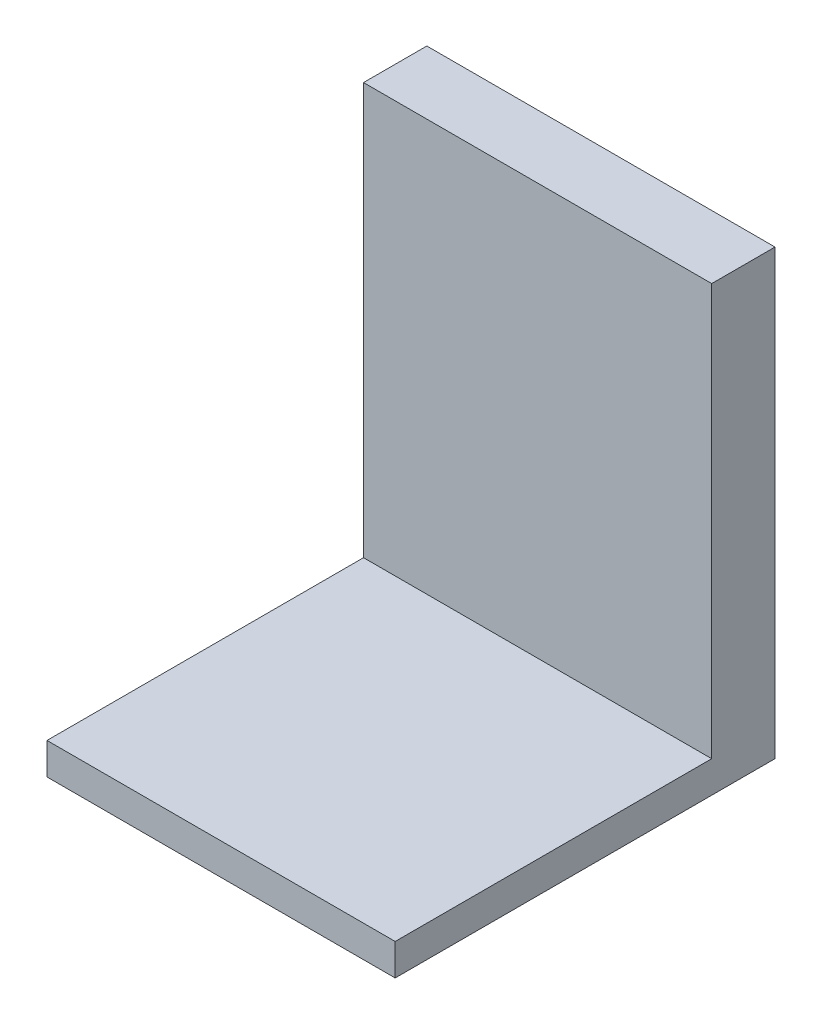
from build123d import *

# Parameters (mm, degrees)
SKETCH1_W                      = 670
SKETCH1_H                      = 120
BOSS_EXTRUDE1_DEPTH            = 530
SKETCH2_W                      = 100
SKETCH2_H                      = 200
SKETCH2_W_2                    = 650
SKETCH2_H_2                    = 250
CUT_EXTRUDE1_DEPTH             = 100
SKETCH3_R                      = 50
CUT_EXTRUDE2_DEPTH             = 260
F_12_0_12_DIAMETER_HOLE2_D     = 12
F_12_0_12_DIAMETER_HOLE2_DEPTH = 30
F_12_0_12_DIAMETER_HOLE2_TIP   = 3.605163714
SKETCH8_W                      = 650
SKETCH8_H                      = 50
BOSS_EXTRUDE2_DEPTH            = 5
SKETCH9_W                      = 10
SKETCH9_H                      = 250
CUT_EXTRUDE3_DEPTH             = 717
CUT_EXTRUDE4_DEPTH             = 5
SKETCH11_W                     = 10
SKETCH11_H                     = 100
BOSS_EXTRUDE3_DEPTH            = 78
BOSS_EXTRUDE3_2_DEPTH          = 78
BOSS_EXTRUDE3_3_DEPTH          = 78
SKETCH12_W                     = 20
SKETCH12_H                     = 30
CUT_EXTRUDE5_DEPTH             = 80
SKETCH15_W                     = 30
SKETCH15_H                     = 23.536156656
SKETCH15_H_2                   = 28.986603691
CUT_EXTRUDE7_DEPTH             = 35
SHELL1_T                       = -3
SKETCH16_W                     = 14
SKETCH16_H                     = 14
CUT_EXTRUDE8_DEPTH             = 35
SKETCH17_W                     = 5.729882812
SKETCH17_H                     = 17.428393554
SKETCH17_W_2                   = 13.369726562
SKETCH17_H_2                   = 3.342431641
BOSS_EXTRUDE4_DEPTH            = 5
CUT_EXTRUDE10_DEPTH            = 863.670273187
CUT_EXTRUDE10_DEPTH_BACK       = 863.670273187
SKETCH18_W                     = 670
SKETCH18_H                     = 250
CUT_EXTRUDE11_DEPTH            = 737.002717386
CUT_EXTRUDE11_DEPTH_BACK       = 737.002717386
SKETCH19_W                     = 448
SKETCH19_H                     = 280
SKETCH19_W_2                   = 112
CUT_EXTRUDE12_DEPTH            = 633.268930124
CUT_EXTRUDE12_DEPTH_BACK       = 633.268930124
SKETCH20_W                     = 110
SKETCH20_H                     = 140


with BuildPart() as part:
    # Sketch1 → Boss-Extrude1 (new body)
    with BuildSketch(Plane(origin=(0, 0, 0), x_dir=(1, 0, 0), z_dir=(0, 1, 0))):
        with Locations((335, 60)):
            Rectangle(SKETCH1_W, SKETCH1_H)
    extrude(amount=BOSS_EXTRUDE1_DEPTH)

    # Sketch2 → Cut-Extrude1 (cut)
    with BuildSketch(Plane.XY):
        with Locations((60, 380)):
            Rectangle(SKETCH2_W, SKETCH2_H)
        with Locations((170, 380)):
            Rectangle(SKETCH2_W, SKETCH2_H)
        with Locations((280, 380)):
            Rectangle(SKETCH2_W, SKETCH2_H)
        with Locations((390, 380)):
            Rectangle(SKETCH2_W, SKETCH2_H)
        with Locations((500, 380)):
            Rectangle(SKETCH2_W, SKETCH2_H)
        with Locations((610, 380)):
            Rectangle(SKETCH2_W, SKETCH2_H)
        with Locations((335, 135)):
            Rectangle(SKETCH2_W_2, SKETCH2_H_2)
    extrude(amount=-CUT_EXTRUDE1_DEPTH, mode=Mode.SUBTRACT)

    # Sketch3 → Cut-Extrude2 (cut)
    with BuildSketch(Plane(origin=(0, 530, 0), x_dir=(1, 0, 0), z_dir=(0, 1, 0))):
        with Locations(Location((60, 60, 0), (0, 0, 270))):
            Circle(SKETCH3_R)
        with Locations(Location((170, 60, 0), (0, 0, 270))):
            Circle(SKETCH3_R)
        with Locations(Location((280, 60, 0), (0, 0, 270))):
            Circle(SKETCH3_R)
        with Locations(Location((390, 60, 0), (0, 0, 270))):
            Circle(SKETCH3_R)
        with Locations(Location((500, 60, 0), (0, 0, 270))):
            Circle(SKETCH3_R)
        with Locations(Location((610, 60, 0), (0, 0, 270))):
            Circle(SKETCH3_R)
    extrude(amount=-CUT_EXTRUDE2_DEPTH, mode=Mode.SUBTRACT)

    # Ø12.0 (12) Diameter Hole2
    with Locations(Plane(origin=(59.704642413, 270, -102.411697903), x_dir=(0, 0, 1), z_dir=(0, 1, 0))):
        with Locations((0, 0), (-0.195888006, 111.8520513), (0.014838595, 221.167624818), (-0.341843303, 331.364008353), (0.657723149, 441.008646429), (1.288998006, 549.811854685)):
            Hole(F_12_0_12_DIAMETER_HOLE2_D / 2, depth=F_12_0_12_DIAMETER_HOLE2_DEPTH)
            with Locations((0, 0, -(F_12_0_12_DIAMETER_HOLE2_DEPTH + F_12_0_12_DIAMETER_HOLE2_TIP / 2))):  # 118° drill point
                Cone(0, F_12_0_12_DIAMETER_HOLE2_D / 2, F_12_0_12_DIAMETER_HOLE2_TIP, mode=Mode.SUBTRACT)

    # Sketch8 → Boss-Extrude2 (add)
    with BuildSketch(Plane.XY):
        with Locations((335, 305)):
            Rectangle(SKETCH8_W, SKETCH8_H)
    extrude(amount=-BOSS_EXTRUDE2_DEPTH)

    # Sketch9 → Cut-Extrude3 (cut)
    with BuildSketch(Plane(origin=(670, 0, 0), x_dir=(0, 0, -1), z_dir=(1, 0, 0))):
        with Locations((15, 135)):
            Rectangle(SKETCH9_W, SKETCH9_H)
    extrude(amount=-CUT_EXTRUDE3_DEPTH, mode=Mode.SUBTRACT)

    # Sketch10 → Cut-Extrude4 (cut)
    with BuildSketch(Plane(origin=(0, 10, 0), x_dir=(1, 0, 0), z_dir=(0, 1, 0))):
        Polygon((365, 61.943560596), (350, 87.924322709), (320, 87.924322709), (305, 61.943560596), (320, 35.962798482), (350, 35.962798482), align=None)
    extrude(amount=-CUT_EXTRUDE4_DEPTH, mode=Mode.SUBTRACT)

    # Sketch12 → Cut-Extrude5 (cut)
    with BuildSketch(Plane.XY.offset(-100)):
        with Locations((85.198613037, 245)):
            Rectangle(SKETCH12_W, SKETCH12_H)
        with Locations((195.198613037, 245)):
            Rectangle(SKETCH12_W, SKETCH12_H)
        with Locations((305.198613037, 245)):
            Rectangle(SKETCH12_W, SKETCH12_H)
        with Locations((415.198613037, 245)):
            Rectangle(SKETCH12_W, SKETCH12_H)
        with Locations((525.198613037, 245)):
            Rectangle(SKETCH12_W, SKETCH12_H)
        with Locations((635.198613037, 245)):
            Rectangle(SKETCH12_W, SKETCH12_H)
    extrude(amount=-CUT_EXTRUDE5_DEPTH, mode=Mode.SUBTRACT)

    # Sketch17 → Boss-Extrude4 (add)
    # profile 1 of 9: a face of its own
    with BuildSketch(Plane.XY):
        with BuildLine():
            Line((527.508830928, 289.835452458), (527.508830928, 307.263846012))
            Line((527.508830928, 307.263846012), (534.861434459, 307.263846012))
            add(Edge.make_bspline(
                [(534.861434459, 307.263846012), (535.181337774, 307.258256848), (535.803061116, 307.24739446), (536.703508491, 307.139069344), (537.544992916, 306.975202489), (538.325061607, 306.737496792), (539.040841948, 306.426020155), (539.698044515, 306.051894954), (540.290333057, 305.605079277), (540.822348212, 305.090232636), (541.284521701, 304.502523111), (541.692171296, 303.852565801), (542.030284458, 303.129762281), (542.309377095, 302.341316546), (542.5243908, 301.484161689), (542.679660381, 300.560045938), (542.773357357, 299.567500804), (542.783368073, 298.883107022), (542.788518428, 298.530997273)],
                knots=[0, 0, 0, 0, 1.135059408, 2.20595691, 3.214417064, 4.174978569, 5.094187092, 5.980001006, 6.853065862, 7.720814779, 8.600404634, 9.50058483, 10.438414914, 11.426825708, 12.465239141, 13.571113463, 14.750376389, 16, 16, 16, 16], degree=3))
            add(Edge.make_bspline(
                [(542.788518428, 298.530997273), (542.781740751, 298.180151665), (542.768592871, 297.499553336), (542.676885992, 296.511518461), (542.516733301, 295.591080531), (542.296748778, 294.736450427), (542.003051046, 293.953120444), (541.654236167, 293.233205539), (541.233025793, 292.585291498), (540.753136904, 292.000029304), (540.204772188, 291.484681411), (539.587651059, 291.044279297), (538.910779309, 290.668464036), (538.169670382, 290.361903209), (537.364073889, 290.124869172), (536.495133477, 289.954199984), (535.562644449, 289.853487388), (534.920131033, 289.841584621), (534.58911581, 289.835452458)],
                knots=[0, 0, 0, 0, 1.228418252, 2.382983832, 3.470276728, 4.496757894, 5.468023682, 6.394867725, 7.292157164, 8.167372942, 9.039072913, 9.918728341, 10.815246345, 11.744296628, 12.720973084, 13.750736166, 14.841206188, 16, 16, 16, 16], degree=3))
            Line((534.58911581, 289.835452458), (527.508830928, 289.835452458))
        make_face()
        with BuildLine():
            Line((533.238713741, 291.745413395), (534.048208904, 291.745413395))
            add(Edge.make_bspline(
                [(534.048208904, 291.745413395), (534.172894012, 291.749291978), (534.413033311, 291.756761998), (534.758676231, 291.825976613), (535.075745017, 291.938271137), (535.365749176, 292.094802589), (535.623404602, 292.300450923), (535.848862806, 292.551404902), (536.04776914, 292.844737637), (536.217685755, 293.190205032), (536.364284647, 293.596533622), (536.481764702, 294.076367921), (536.592118304, 294.630928744), (536.673672739, 295.265507643), (536.740044562, 295.978448886), (536.788346679, 296.768428292), (536.812018936, 297.636801208), (536.817188964, 298.241258393), (536.819890499, 298.55711002)],
                knots=[0, 0, 0, 0, 0.728710832, 1.403472396, 2.052289494, 2.690292559, 3.321919393, 3.970736491, 4.656696891, 5.388631723, 6.217040872, 7.17856157, 8.275589967, 9.523440737, 10.918935818, 12.463926104, 14.152268318, 16, 16, 16, 16], degree=3))
            add(Edge.make_bspline(
                [(536.819890499, 298.55711002), (536.8171426, 298.871715251), (536.811863063, 299.476166083), (536.7886758, 300.343334385), (536.739579947, 301.133216935), (536.674703848, 301.843934916), (536.589660404, 302.476324031), (536.488366458, 303.031681737), (536.362441588, 303.507627045), (536.222158727, 303.914921549), (536.050140993, 304.256514038), (535.858357073, 304.554097881), (535.62547107, 304.79746827), (535.36991257, 305.004888479), (535.079348843, 305.160875844), (534.761320266, 305.273944358), (534.414185903, 305.34216807), (534.172870641, 305.349893944), (534.048208904, 305.353885075)],
                knots=[0, 0, 0, 0, 1.842836665, 3.540640921, 5.080358154, 6.47765669, 7.719902824, 8.816971715, 9.781579111, 10.601733135, 11.334613876, 12.017393917, 12.666641099, 13.29908421, 13.937911793, 14.587567384, 15.270347425, 16, 16, 16, 16], degree=3))
            Line((534.048208904, 305.353885075), (533.238713741, 305.353885075))
            Line((533.238713741, 305.353885075), (533.238713741, 291.745413395))
        make_face(mode=Mode.SUBTRACT)
    # profile 2 of 9: a face of its own
    with BuildSketch(Plane.XY):
        with Locations((547.563420772, 298.549649235)):
            Rectangle(SKETCH17_W, SKETCH17_H)
    # profile 3 of 9: a face of its own
    with BuildSketch(Plane.XY):
        Polygon((564.514324092, 307.263846012), (564.514324092, 305.115139958), (558.545696163, 305.115139958), (558.545696163, 299.862747379), (563.559343624, 299.862747379), (563.559343624, 297.714041325), (558.545696163, 297.714041325), (558.545696163, 289.835452458), (552.81581335, 289.835452458), (552.81581335, 307.263846012), align=None)
    # profile 4 of 9: a face of its own
    with BuildSketch(Plane.XY):
        Polygon((577.645305538, 307.263846012), (577.645305538, 305.115139958), (571.676677608, 305.115139958), (571.676677608, 299.862747379), (576.690325069, 299.862747379), (576.690325069, 297.714041325), (571.676677608, 297.714041325), (571.676677608, 289.835452458), (565.946794795, 289.835452458), (565.946794795, 307.263846012), align=None)
    # profile 5 of 9: a face of its own
    with BuildSketch(Plane.XY):
        with Locations((584.330168819, 287.448001286)):
            Rectangle(SKETCH17_W_2, SKETCH17_H_2)
    # profile 6 of 9: a face of its own
    with BuildSketch(Plane.XY):
        with BuildLine():
            Line((605.578484249, 307.263846012), (605.578484249, 295.602639195))
            add(Edge.make_bspline(
                [(605.578484249, 295.602639195), (605.574209777, 295.35989389), (605.565919345, 294.889083964), (605.480877158, 294.20653885), (605.349958188, 293.569747554), (605.15926554, 292.978838165), (604.911867049, 292.436847071), (604.616163877, 291.936663973), (604.260702644, 291.487723021), (603.847299908, 291.08966617), (603.386881991, 290.731670113), (602.867295001, 290.425440037), (602.293741958, 290.168488385), (601.66690529, 289.960990771), (600.988052682, 289.797299786), (600.254912883, 289.679078851), (599.467035781, 289.60781007), (598.923618241, 289.60048219), (598.643684673, 289.59670734)],
                knots=[0, 0, 0, 0, 1.108173197, 2.149326602, 3.136215123, 4.073726706, 4.978516626, 5.852185058, 6.72141202, 7.584905625, 8.467554395, 9.379216169, 10.332422268, 11.332766067, 12.390653242, 13.518530507, 14.721707419, 16, 16, 16, 16], degree=3))
            add(Edge.make_bspline(
                [(598.643684673, 289.59670734), (598.373688491, 289.600411437), (597.851346557, 289.607577482), (597.093280473, 289.679448684), (596.387523889, 289.797736542), (595.733050135, 289.960122315), (595.130189942, 290.169220301), (594.579048171, 290.42623041), (594.078350789, 290.732835498), (593.633858028, 291.090104794), (593.234289459, 291.486851767), (592.899913678, 291.940746827), (592.609043638, 292.435866034), (592.375223767, 292.980322997), (592.191754821, 293.570441519), (592.063541006, 294.20666921), (591.983676196, 294.889343196), (591.974661767, 295.359932437), (591.970012569, 295.602639195)],
                knots=[0, 0, 0, 0, 1.258901956, 2.435505865, 3.547148904, 4.59359074, 5.576649289, 6.5183682, 7.424469602, 8.307507093, 9.172751023, 10.042627298, 10.928839176, 11.845659241, 12.799442865, 13.80597989, 14.868432463, 16, 16, 16, 16], degree=3))
            Line((591.970012569, 295.602639195), (591.970012569, 307.263846012))
            Line((591.970012569, 307.263846012), (597.699895381, 307.263846012))
            Line((597.699895381, 307.263846012), (597.699895381, 295.457153889))
            add(Edge.make_bspline(
                [(597.699895381, 295.457153889), (597.700816195, 295.287996189), (597.702584578, 294.963135903), (597.729908723, 294.499051493), (597.768241004, 294.079064133), (597.828226169, 293.705517832), (597.90066041, 293.377063412), (597.989882091, 293.09281535), (598.094998068, 292.852496478), (598.225239063, 292.654232043), (598.380826623, 292.495135011), (598.55368342, 292.353231761), (598.757556996, 292.238543846), (598.987648905, 292.146224908), (599.243380948, 292.070549638), (599.526120553, 292.020376099), (599.83553351, 291.990763905), (600.049971942, 291.986424568), (600.161954402, 291.984158512)],
                knots=[0, 0, 0, 0, 1.622370975, 3.115695595, 4.458049099, 5.666011203, 6.742434742, 7.681714947, 8.519814998, 9.250928664, 9.942747364, 10.646898194, 11.389596108, 12.175933929, 13.021386247, 13.943159715, 14.925891993, 16, 16, 16, 16], degree=3))
            add(Edge.make_bspline(
                [(600.161954402, 291.984158512), (600.283927219, 291.987190593), (600.521124756, 291.993087005), (600.86597014, 292.03390861), (601.187714881, 292.103380086), (601.484890424, 292.205377303), (601.758665297, 292.332852529), (602.012761516, 292.484567923), (602.236391413, 292.674631152), (602.439076761, 292.888441291), (602.620738276, 293.128529789), (602.771757722, 293.399928575), (602.905501548, 293.697121508), (603.005823683, 294.025060118), (603.089837826, 294.379999499), (603.146989706, 294.763086929), (603.186210275, 295.174074524), (603.189394751, 295.457053988), (603.191033077, 295.602639195)],
                knots=[0, 0, 0, 0, 1.083870311, 2.107775948, 3.08105344, 4.003637981, 4.893545291, 5.761570557, 6.624657808, 7.49233129, 8.376387281, 9.291996285, 10.246843261, 11.267344133, 12.334180325, 13.486053461, 14.706643157, 16, 16, 16, 16], degree=3))
            Line((603.191033077, 295.602639195), (603.191033077, 307.263846012))
            Line((603.191033077, 307.263846012), (605.578484249, 307.263846012))
        make_face()
    # profile 7 of 9: a face of its own
    with BuildSketch(Plane.XY):
        with BuildLine():
            Line((619.731593227, 302.015183827), (616.739818477, 301.526502415))
            add(Edge.make_bspline(
                [(616.739818477, 301.526502415), (616.748849224, 301.670726223), (616.765660669, 301.939210177), (616.78429066, 302.312269209), (616.796668381, 302.625642376), (616.798628236, 302.814722915), (616.799504756, 302.899286839)],
                knots=[0, 0, 0, 0, 1.261802504, 2.348944521, 3.261585937, 4, 4, 4, 4], degree=3))
            add(Edge.make_bspline(
                [(616.799504756, 302.899286839), (616.798306068, 303.007660677), (616.795968139, 303.219033721), (616.750451916, 303.523894877), (616.694806916, 303.811547356), (616.604352699, 304.076787391), (616.488181329, 304.320314265), (616.348943917, 304.543955606), (616.184187178, 304.745078709), (615.995833421, 304.928129987), (615.778009957, 305.083200131), (615.536269472, 305.218702836), (615.269765326, 305.333844758), (614.978065514, 305.431346685), (614.660683072, 305.504624438), (614.319025281, 305.556776695), (613.952471696, 305.585673441), (613.699597795, 305.590260771), (613.568984889, 305.592630192)],
                knots=[0, 0, 0, 0, 1.079280541, 2.105035848, 3.067950317, 3.99715044, 4.889989748, 5.753421302, 6.617030865, 7.476358039, 8.364190572, 9.274590025, 10.235106994, 11.254473582, 12.337095886, 13.478601727, 14.697662529, 16, 16, 16, 16], degree=3))
            add(Edge.make_bspline(
                [(613.568984889, 305.592630192), (613.391954632, 305.58912286), (613.059112606, 305.582528579), (612.595688488, 305.495339748), (612.198743126, 305.361419257), (611.87165349, 305.163811893), (611.613188167, 304.909795747), (611.433841092, 304.593316589), (611.323009072, 304.224665915), (611.313400221, 303.959558324), (611.308367061, 303.820693775)],
                knots=[0, 0, 0, 0, 1.294917039, 2.43462794, 3.440028966, 4.347597256, 5.210608309, 6.06356377, 6.985685997, 8, 8, 8, 8], degree=3))
            add(Edge.make_bspline(
                [(611.308367061, 303.820693775), (611.317562032, 303.705133219), (611.336106628, 303.472068433), (611.47315858, 303.132808312), (611.695999602, 302.811560885), (612.009295906, 302.510664216), (612.404107796, 302.221967273), (612.884407504, 301.948533431), (613.450813789, 301.688189695), (613.862519081, 301.536023727), (614.080048656, 301.455624958)],
                knots=[0, 0, 0, 0, 0.716839541, 1.445735977, 2.240793036, 3.131329288, 4.131129903, 5.273471266, 6.559404876, 8, 8, 8, 8], degree=3))
            add(Edge.make_bspline(
                [(614.080048656, 301.455624958), (614.335934702, 301.364918412), (614.834564244, 301.188164095), (615.547657928, 300.88707802), (616.213068388, 300.5749594), (616.829579094, 300.246613346), (617.397833174, 299.90520698), (617.914851624, 299.544556457), (618.386199073, 299.173962102), (618.807001026, 298.783874588), (619.177995113, 298.378100064), (619.4958685, 297.952745357), (619.771807525, 297.51723103), (619.991113975, 297.061458502), (620.169645242, 296.594624218), (620.292698657, 296.11024444), (620.364288243, 295.609761088), (620.37516617, 295.270864226), (620.380681514, 295.099036213)],
                knots=[0, 0, 0, 0, 1.359488612, 2.649152603, 3.874964776, 5.039588756, 6.146130126, 7.193090393, 8.194917302, 9.146793662, 10.063845301, 10.944476293, 11.803344532, 12.641736646, 13.473440096, 14.302714936, 15.139439897, 16, 16, 16, 16], degree=3))
            add(Edge.make_bspline(
                [(620.380681514, 295.099036213), (620.374476075, 294.902306495), (620.362285176, 294.515820995), (620.280160209, 293.948630617), (620.138011896, 293.409496554), (619.938489338, 292.895972278), (619.681049879, 292.411946655), (619.366518754, 291.954381076), (618.996510229, 291.525099427), (618.5710008, 291.128381035), (618.102222518, 290.765302239), (617.587803957, 290.450854345), (617.034458515, 290.187092261), (616.444107988, 289.968993032), (615.81453624, 289.801373099), (615.145337453, 289.685291013), (614.438790193, 289.606619894), (613.954683001, 289.600062276), (613.70700941, 289.59670734)],
                knots=[0, 0, 0, 0, 0.972121714, 1.909782367, 2.824924061, 3.721832975, 4.62620438, 5.527836938, 6.46026819, 7.421000932, 8.398101015, 9.385579713, 10.394244048, 11.422703992, 12.491421888, 13.608778581, 14.776629625, 16, 16, 16, 16], degree=3))
            add(Edge.make_bspline(
                [(613.70700941, 289.59670734), (613.445745367, 289.599650312), (612.939893069, 289.605348413), (612.207608113, 289.66709241), (611.525297432, 289.760984454), (610.893395078, 289.899706116), (610.309273131, 290.072394336), (609.776099392, 290.288320955), (609.295310255, 290.547303481), (608.863217672, 290.843007892), (608.478306623, 291.175775461), (608.148120946, 291.551766865), (607.86942369, 291.967163224), (607.639947144, 292.421521488), (607.466477665, 292.917583541), (607.339164663, 293.449829748), (607.264537999, 294.021332449), (607.254747521, 294.414908557), (607.249700069, 294.617815586)],
                knots=[0, 0, 0, 0, 1.342201143, 2.598733168, 3.773451092, 4.878874364, 5.91991243, 6.900006476, 7.829142054, 8.72062616, 9.585588575, 10.436728592, 11.283829734, 12.149664931, 13.044964919, 13.977937424, 14.957531465, 16, 16, 16, 16], degree=3))
            add(Edge.make_bspline(
                [(607.249700069, 294.617815586), (607.250803815, 294.692425759), (607.253213998, 294.855347393), (607.260452266, 295.122772538), (607.275636683, 295.433682216), (607.29037174, 295.656130545), (607.298195171, 295.774237248)],
                knots=[0, 0, 0, 0, 0.773500207, 1.689044709, 2.77302154, 4, 4, 4, 4], degree=3))
            Line((607.298195171, 295.774237248), (610.36457777, 296.337526509))
            add(Edge.make_bspline(
                [(610.36457777, 296.337526509), (610.326952988, 296.136337493), (610.255606535, 295.754830366), (610.178678473, 295.21219969), (610.124206629, 294.733311493), (610.11767002, 294.435147371), (610.114641475, 294.297001835)],
                knots=[0, 0, 0, 0, 1.192988372, 2.262218769, 3.194850416, 4, 4, 4, 4], degree=3))
            add(Edge.make_bspline(
                [(610.114641475, 294.297001835), (610.116191817, 294.183708768), (610.119182568, 293.965156219), (610.159053378, 293.648552813), (610.215988606, 293.352999663), (610.302906772, 293.079707227), (610.411206928, 292.826307836), (610.544682453, 292.59538211), (610.704385489, 292.386485019), (610.887496571, 292.200099922), (611.094689168, 292.033628705), (611.327456494, 291.892756696), (611.58347653, 291.771733922), (611.864681562, 291.677479524), (612.167961721, 291.596080628), (612.497219749, 291.548235723), (612.849461228, 291.512043782), (613.092629543, 291.508500084), (613.218327999, 291.506668278)],
                knots=[0, 0, 0, 0, 1.135776692, 2.191015738, 3.19649269, 4.151244236, 5.061952528, 5.956281389, 6.819534407, 7.692823504, 8.571441916, 9.478554956, 10.416037156, 11.406231466, 12.450054172, 13.561596327, 14.739541482, 16, 16, 16, 16], degree=3))
            add(Edge.make_bspline(
                [(613.218327999, 291.506668278), (613.423996012, 291.510791273), (613.810619321, 291.518541853), (614.349272542, 291.616708407), (614.810575885, 291.768742445), (615.189785268, 291.991387532), (615.490778961, 292.278756613), (615.698005174, 292.637320004), (615.824813318, 293.05638326), (615.837728413, 293.355975238), (615.844524288, 293.513619419)],
                knots=[0, 0, 0, 0, 1.308765556, 2.460272085, 3.475015317, 4.388076298, 5.239673503, 6.095681635, 6.997954785, 8, 8, 8, 8], degree=3))
            add(Edge.make_bspline(
                [(615.844524288, 293.513619419), (615.833808824, 293.638242951), (615.811807312, 293.894126055), (615.644884004, 294.264515838), (615.382382362, 294.620631473), (615.016807277, 294.962984909), (614.551376589, 295.293471235), (613.986957743, 295.616730224), (613.322148235, 295.933112033), (612.83677959, 296.119639164), (612.580430889, 296.21815395)],
                knots=[0, 0, 0, 0, 0.667930748, 1.371427933, 2.146459016, 3.034714139, 4.04893387, 5.207327294, 6.525042705, 8, 8, 8, 8], degree=3))
            add(Edge.make_bspline(
                [(612.580430889, 296.21815395), (612.374354345, 296.29679374), (611.970646869, 296.450850434), (611.394079385, 296.713586304), (610.853066711, 296.987016804), (610.357486361, 297.288235735), (609.896382561, 297.599610528), (609.477036946, 297.932256792), (609.09841673, 298.284556341), (608.758710772, 298.653375077), (608.457302107, 299.038989264), (608.199448649, 299.444659231), (607.977533299, 299.866789834), (607.798609588, 300.308107488), (607.65975715, 300.767821241), (607.559616231, 301.244439392), (607.497905054, 301.739995674), (607.491630423, 302.075933546), (607.488445186, 302.246468159)],
                knots=[0, 0, 0, 0, 1.249558333, 2.447906163, 3.58867143, 4.682264114, 5.731748367, 6.739728761, 7.711906036, 8.659384707, 9.578321416, 10.481344598, 11.379544271, 12.277135726, 13.175418307, 14.097160112, 15.034047388, 16, 16, 16, 16], degree=3))
            add(Edge.make_bspline(
                [(607.488445186, 302.246468159), (607.49282555, 302.439538736), (607.501402184, 302.817565692), (607.587451154, 303.36980586), (607.719291893, 303.894921371), (607.910558542, 304.389343064), (608.156192894, 304.852853762), (608.453187669, 305.288766511), (608.804241719, 305.697593471), (609.213503754, 306.066686531), (609.657214714, 306.407618241), (610.14376173, 306.697651931), (610.658716537, 306.950861947), (611.210636666, 307.148827868), (611.791820619, 307.313252612), (612.408080529, 307.421140415), (613.056315391, 307.490701612), (613.499160755, 307.498567824), (613.725661373, 307.502591129)],
                knots=[0, 0, 0, 0, 1.01033566, 1.978209831, 2.919499157, 3.840961976, 4.746855014, 5.660740114, 6.597989116, 7.56120833, 8.541877795, 9.523498025, 10.522416858, 11.542172371, 12.589598349, 13.681636521, 14.814234488, 16, 16, 16, 16], degree=3))
            add(Edge.make_bspline(
                [(613.725661373, 307.502591129), (613.968269855, 307.498219033), (614.438190994, 307.489750488), (615.120391152, 307.426787419), (615.755073228, 307.319142339), (616.345153155, 307.171557286), (616.887304575, 306.977590666), (617.384933999, 306.742393454), (617.834452216, 306.46201507), (618.236961315, 306.139451502), (618.593086714, 305.773322851), (618.897467704, 305.361641069), (619.158701245, 304.909408454), (619.366684143, 304.412232174), (619.529870326, 303.873247147), (619.649133834, 303.29158184), (619.720420497, 302.667301443), (619.72779778, 302.236712324), (619.731593227, 302.015183827)],
                knots=[0, 0, 0, 0, 1.248314423, 2.417925914, 3.521398822, 4.558068205, 5.543720209, 6.479599284, 7.385061127, 8.263440163, 9.127722873, 10.00561236, 10.891325273, 11.808802823, 12.772251995, 13.784947978, 14.860405143, 16, 16, 16, 16], degree=3))
        make_face()
    # profile 8 of 9: a face of its own
    with BuildSketch(Plane.XY):
        Polygon((633.989153194, 307.263846012), (633.989153194, 305.115139958), (628.020525264, 305.115139958), (628.020525264, 300.340237614), (633.034172725, 300.340237614), (633.034172725, 298.191531559), (628.020525264, 298.191531559), (628.020525264, 291.984158512), (634.944133663, 291.984158512), (634.944133663, 289.835452458), (622.290642452, 289.835452458), (622.290642452, 307.263846012), align=None)
    # profile 9 of 9: a face of its own
    with BuildSketch(Plane.XY):
        with BuildLine():
            Line((636.376604366, 289.835452458), (636.376604366, 307.263846012))
            Line((636.376604366, 307.263846012), (643.990335369, 307.263846012))
            add(Edge.make_bspline(
                [(643.990335369, 307.263846012), (644.237946498, 307.261150834), (644.721600887, 307.25588639), (645.426490561, 307.189203683), (646.094808274, 307.090496236), (646.724915796, 306.949857504), (647.317873659, 306.767252686), (647.871119087, 306.542146), (648.390701058, 306.282329135), (648.864494846, 305.976472528), (649.295093616, 305.642889252), (649.669668547, 305.279483604), (649.990389523, 304.894749072), (650.250664962, 304.483256345), (650.454275633, 304.048690948), (650.59581384, 303.587791605), (650.684089268, 303.104102537), (650.695510601, 302.772834174), (650.701311397, 302.604585835)],
                knots=[0, 0, 0, 0, 1.303269877, 2.545653735, 3.724355284, 4.8584284, 5.941462088, 6.987020715, 8.000098032, 8.995332524, 9.951400474, 10.863507538, 11.737823931, 12.582415999, 13.420128714, 14.25671499, 15.114600608, 16, 16, 16, 16], degree=3))
            add(Edge.make_bspline(
                [(650.701311397, 302.604585835), (650.698282873, 302.472674957), (650.692382063, 302.215658276), (650.651041486, 301.838684287), (650.580643818, 301.480313933), (650.481036683, 301.139915259), (650.347814833, 300.820175594), (650.191279492, 300.517863507), (650.009772227, 300.230553342), (649.788675198, 299.970497982), (649.548268341, 299.722842359), (649.274558803, 299.497116911), (648.974487035, 299.288655528), (648.642526299, 299.104010513), (648.287619671, 298.928055749), (647.899038177, 298.784921972), (647.486819978, 298.644749395), (647.19793098, 298.577036306), (647.049257183, 298.54218845)],
                knots=[0, 0, 0, 0, 1.057156483, 2.059775939, 3.035078039, 3.981068617, 4.897189472, 5.80650904, 6.70770952, 7.613691521, 8.536886357, 9.470937334, 10.45233069, 11.461024139, 12.51295332, 13.623444893, 14.776929983, 16, 16, 16, 16], degree=3))
            add(Edge.make_bspline(
                [(647.049257183, 298.54218845), (647.19164695, 298.499279419), (647.467865022, 298.416041346), (647.856360945, 298.265600017), (648.211652989, 298.111536308), (648.524185739, 297.936781388), (648.807636894, 297.762122504), (649.047122259, 297.564301324), (649.255235567, 297.361673563), (649.425188343, 297.135464734), (649.570253643, 296.882344437), (649.694827156, 296.586596707), (649.815179167, 296.247423665), (649.917667348, 295.859098311), (650.004750555, 295.423699276), (650.088222437, 294.944027189), (650.153853601, 294.416024546), (650.187587341, 294.048412906), (650.2051692, 293.856815525)],
                knots=[0, 0, 0, 0, 1.149282524, 2.229462177, 3.219229774, 4.139917433, 4.995948464, 5.788695735, 6.536448429, 7.236319808, 7.968460079, 8.78645307, 9.713791991, 10.749194692, 11.887975363, 13.146018663, 14.512518948, 16, 16, 16, 16], degree=3))
            add(Edge.make_bspline(
                [(650.2051692, 293.856815525), (650.225980287, 293.627849833), (650.265975604, 293.187817268), (650.348933081, 292.554613589), (650.44386163, 291.974357025), (650.555874504, 291.44528724), (650.681301216, 290.967898855), (650.821280597, 290.540469593), (650.979920039, 290.165788217), (651.10484481, 289.941461656), (651.163880062, 289.835452458)],
                knots=[0, 0, 0, 0, 1.324580516, 2.545615266, 3.678710841, 4.711533017, 5.660403917, 6.521349952, 7.301239649, 8, 8, 8, 8], degree=3))
            Line((651.163880062, 289.835452458), (645.213904094, 289.835452458))
            add(Edge.make_bspline(
                [(645.213904094, 289.835452458), (645.12229736, 290.069847279), (644.935171241, 290.548648246), (644.7595281, 291.319414791), (644.64846922, 292.142514735), (644.635117598, 292.70994511), (644.628232479, 293.002555653)],
                knots=[0, 0, 0, 0, 0.930410518, 1.900560147, 2.917368081, 4, 4, 4, 4], degree=3))
            Line((644.628232479, 293.002555653), (644.605850124, 294.002300831))
            Line((644.605850124, 294.002300831), (644.579737377, 295.266903874))
            add(Edge.make_bspline(
                [(644.579737377, 295.266903874), (644.573694669, 295.477395004), (644.562357007, 295.872330118), (644.469348432, 296.426164013), (644.30178735, 296.894645884), (644.073222546, 297.287223005), (643.766741442, 297.590613479), (643.39104803, 297.804152917), (642.950456912, 297.93396284), (642.634664848, 297.946292392), (642.468335247, 297.952786442)],
                knots=[0, 0, 0, 0, 1.295300309, 2.430314163, 3.439929415, 4.342995669, 5.203512789, 6.060756153, 6.978588463, 8, 8, 8, 8], degree=3))
            Line((642.468335247, 297.952786442), (642.106487178, 297.952786442))
            Line((642.106487178, 297.952786442), (642.106487178, 289.835452458))
            Line((642.106487178, 289.835452458), (636.376604366, 289.835452458))
        make_face()
        with BuildLine():
            Line((642.106487178, 299.862747379), (642.617550945, 299.862747379))
            add(Edge.make_bspline(
                [(642.617550945, 299.862747379), (642.722054451, 299.865172716), (642.925280724, 299.869889229), (643.220054897, 299.898289891), (643.494111408, 299.951809873), (643.749840966, 300.021017819), (643.984372137, 300.114851792), (644.200147241, 300.225818296), (644.391160406, 300.362685327), (644.565327067, 300.516342321), (644.718148635, 300.691986294), (644.850351299, 300.889034217), (644.961199162, 301.106225057), (645.056078491, 301.342818683), (645.125883912, 301.600830857), (645.173262731, 301.879472914), (645.203404658, 302.177423605), (645.207875435, 302.383174491), (645.210173702, 302.488943669)],
                knots=[0, 0, 0, 0, 1.184986479, 2.304423995, 3.352332712, 4.347714965, 5.303263624, 6.211353909, 7.091434645, 7.960150225, 8.839440182, 9.723126897, 10.64371617, 11.599264829, 12.608232147, 13.667459739, 14.800924404, 16, 16, 16, 16], degree=3))
            add(Edge.make_bspline(
                [(645.210173702, 302.488943669), (645.207875435, 302.594712847), (645.203404658, 302.800463732), (645.173262731, 303.098414423), (645.125883912, 303.37705648), (645.056078491, 303.635068654), (644.961199162, 303.87166228), (644.850351299, 304.08885312), (644.718148635, 304.285901043), (644.565327067, 304.461545017), (644.391160406, 304.61520201), (644.200147241, 304.752069041), (643.984372137, 304.863035546), (643.749840966, 304.956869518), (643.494111408, 305.026077464), (643.220054897, 305.079597446), (642.925280724, 305.107998108), (642.722054451, 305.112714621), (642.617550945, 305.115139958)],
                knots=[0, 0, 0, 0, 1.199075596, 2.332540261, 3.391767853, 4.400735171, 5.35628383, 6.276873103, 7.160559818, 8.039849775, 8.908565355, 9.788646091, 10.696736376, 11.652285035, 12.647667288, 13.695576005, 14.815013521, 16, 16, 16, 16], degree=3))
            Line((642.617550945, 305.115139958), (642.106487178, 305.115139958))
            Line((642.106487178, 305.115139958), (642.106487178, 299.862747379))
        make_face(mode=Mode.SUBTRACT)
    extrude(amount=BOSS_EXTRUDE4_DEPTH)

    # Sketch18 → Cut-Extrude10 (cut, two sides: drawn at the far end of the back side and taken through both)
    with BuildSketch(Plane.XY.offset(-CUT_EXTRUDE10_DEPTH_BACK)):
        with Locations((335, 405)):
            Rectangle(SKETCH18_W, SKETCH18_H)
    extrude(amount=CUT_EXTRUDE10_DEPTH + CUT_EXTRUDE10_DEPTH_BACK, mode=Mode.SUBTRACT)

    # Sketch19 → Cut-Extrude11 (cut, two sides: drawn at the far end of the back side and taken through both)
    with BuildSketch(Plane(origin=(0, 0, -120), x_dir=(-1, 0, 0), z_dir=(0, 0, -1)).offset(-CUT_EXTRUDE11_DEPTH_BACK)):
        with Locations((-224, 140)):
            Rectangle(SKETCH19_W, SKETCH19_H)
        with Locations((-614, 140)):
            Rectangle(SKETCH19_W_2, SKETCH19_H)
    extrude(amount=CUT_EXTRUDE11_DEPTH + CUT_EXTRUDE11_DEPTH_BACK, mode=Mode.SUBTRACT)

    # Sketch20 → Cut-Extrude12 (cut, two sides: drawn at the far end of the back side and taken through both)
    with BuildSketch(Plane.XY.offset(-100).offset(-CUT_EXTRUDE12_DEPTH_BACK)):
        with Locations((503, 210)):
            Rectangle(SKETCH20_W, SKETCH20_H)
    extrude(amount=CUT_EXTRUDE12_DEPTH + CUT_EXTRUDE12_DEPTH_BACK, mode=Mode.SUBTRACT)


with BuildPart() as body_2:
    # Sketch11 → Boss-Extrude3 (new body)
    with BuildSketch(Plane.XY.offset(-100)):
        with Locations((255, 60)):
            Rectangle(SKETCH11_W, SKETCH11_H)
    extrude(amount=BOSS_EXTRUDE3_DEPTH)


with BuildPart() as body_3:
    # Sketch11 → Boss-Extrude3 2 (new body)
    with BuildSketch(Plane.XY.offset(-100)):
        with Locations((415, 60)):
            Rectangle(SKETCH11_W, SKETCH11_H)
    extrude(amount=BOSS_EXTRUDE3_2_DEPTH)


with BuildPart() as body_4:
    # Sketch11 → Boss-Extrude3 3 (new body)
    with BuildSketch(Plane.XY.offset(-100)):
        Polygon((25, 198.45686471), (325, 145.558770497), (325, 122.01775856), (345, 122.01775856), (345, 145.558770497), (645, 198.45686471), align=None)
    extrude(amount=BOSS_EXTRUDE3_3_DEPTH)

    # Sketch15 → Cut-Extrude7 (cut)
    with BuildSketch(Plane(origin=(345, 0, 0), x_dir=(0, 0, -1), z_dir=(1, 0, 0))):
        with Locations((35, 133.231921672)):
            Rectangle(SKETCH15_W, SKETCH15_H)
        with Locations((85, 130.506698154)):
            Rectangle(SKETCH15_W, SKETCH15_H_2)
    extrude(amount=-CUT_EXTRUDE7_DEPTH, mode=Mode.SUBTRACT)

    # Shell1
    shell1_openings = [body_4.faces().sort_by_distance(p)[0] for p in [
        (335, 198.45686471, -61),
    ]]
    offset(amount=SHELL1_T, openings=shell1_openings, kind=Kind.INTERSECTION)

    # Sketch16 → Cut-Extrude8 (cut)
    with BuildSketch(Plane.XZ.offset(-122.01775856)):
        with Locations((335, -60)):
            Rectangle(SKETCH16_W, SKETCH16_H)
    extrude(amount=-CUT_EXTRUDE8_DEPTH, mode=Mode.SUBTRACT)


solid = part.part
